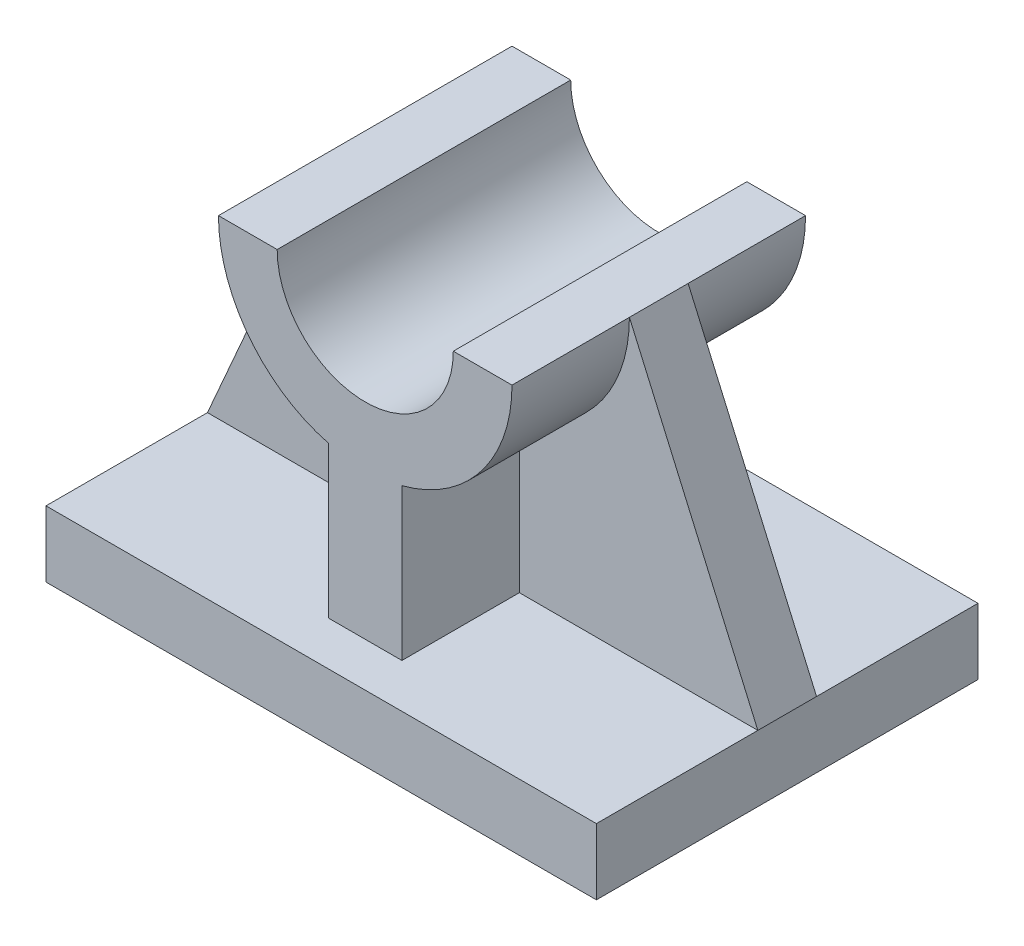
from build123d import *

# Parameters (mm, degrees)
BOSS_EXTRUDE1_DEPTH = 26
BOSS_EXTRUDE2_DEPTH = 20
BOSS_EXTRUDE3_DEPTH = 4


with BuildPart() as part:
    # Sketch2 → Boss-Extrude1 (new, symmetric)
    with BuildSketch(Plane.XY):
        Polygon((-5, -40), (-37.5, -40), (-37.5, -49), (37.5, -49), (37.5, -40), (5, -40), align=None)
    extrude(amount=BOSS_EXTRUDE1_DEPTH, both=True)

    # Sketch2<4> → Boss-Extrude2 (add, symmetric)
    with BuildSketch(Plane.XY):
        with BuildLine():
            Line((-12, 0), (-20, 0))
            ThreePointArc((-20, 0), (-15.811388301, -12.247448714), (-5, -19.364916731))
            Line((-5, -19.364916731), (-5, -40))
            Line((-5, -40), (5, -40))
            Line((5, -40), (5, -19.364916731))
            ThreePointArc((5, -19.364916731), (15.811388301, -12.247448714), (20, 0))
            Line((20, 0), (12, 0))
            ThreePointArc((12, 0), (0, -12), (-12, 0))
        make_face()
    extrude(amount=BOSS_EXTRUDE2_DEPTH, both=True)

    # Sketch2<5> → Boss-Extrude3 (add, symmetric)
    with BuildSketch(Plane.XY):
        with BuildLine():
            ThreePointArc((-5, -19.364916731), (-15.811388301, -12.247448714), (-20, 0))
            Line((-20, 0), (-37.5, -40))
            Line((-37.5, -40), (-5, -40))
            Line((-5, -40), (-5, -19.364916731))
        make_face()
        with BuildLine():
            Line((37.5, -40), (20, 0))
            ThreePointArc((20, 0), (15.811388301, -12.247448714), (5, -19.364916731))
            Line((5, -19.364916731), (5, -40))
            Line((5, -40), (37.5, -40))
        make_face()
    extrude(amount=BOSS_EXTRUDE3_DEPTH, both=True)


solid = part.part
